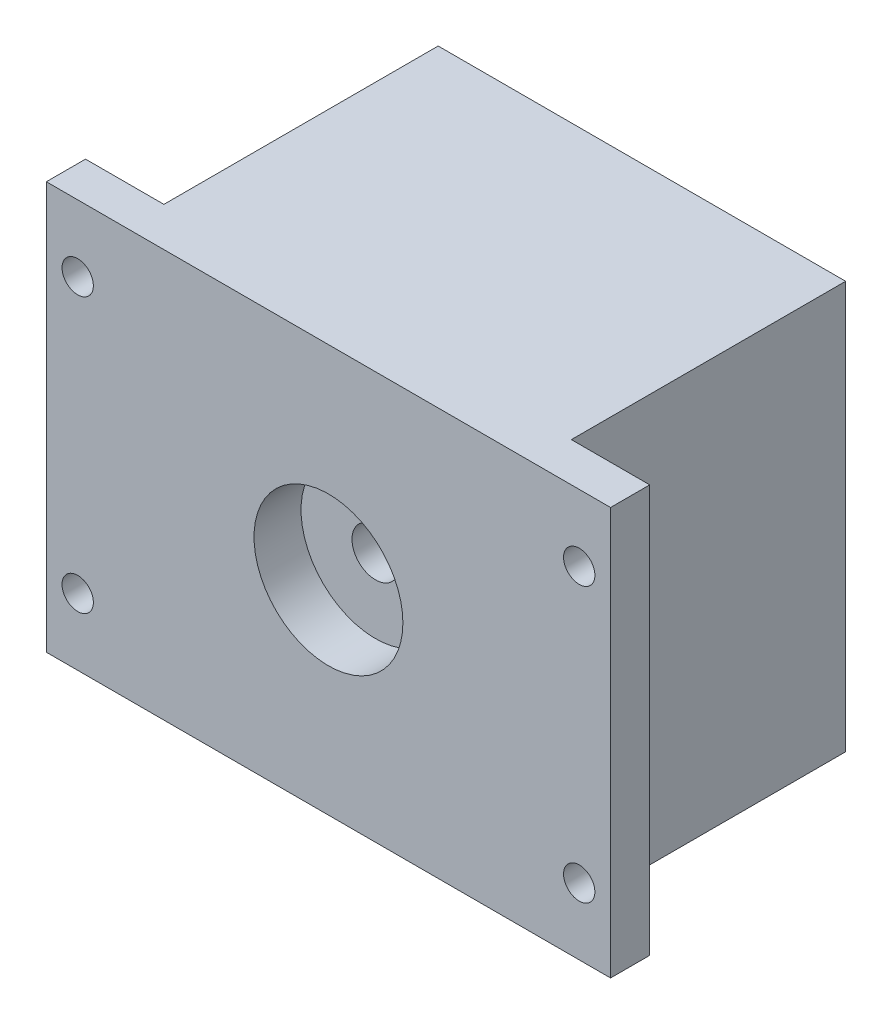
from build123d import *

# Parameters (mm, degrees)
SKETCH3_W           = 52
SKETCH3_H           = 52
BOSS_EXTRUDE1_DEPTH = 40
SKETCH4_R           = 3
CUT_EXTRUDE5_DEPTH  = 40
SKETCH4_5_R         = 9.5
SKETCH4_5_R_2       = 3
CUT_EXTRUDE6_DEPTH  = 6
CUT_EXTRUDE8_START  = -6
SKETCH5_R           = 9.5
CUT_EXTRUDE8_DEPTH  = 6
SKETCH6_W           = 10
SKETCH6_H           = 52
BOSS_EXTRUDE2_DEPTH = 5
SKETCH7_R           = 2
CUT_EXTRUDE9_DEPTH  = 5


with BuildPart() as part:
    # Sketch3 → Boss-Extrude1 (new body)
    with BuildSketch(Plane.XY):
        Rectangle(SKETCH3_W, SKETCH3_H)
    extrude(amount=BOSS_EXTRUDE1_DEPTH)

    # Sketch4 → Cut-Extrude5 (cut)
    with BuildSketch(Plane.XY.offset(40)):
        Circle(SKETCH4_R)
    extrude(amount=-CUT_EXTRUDE5_DEPTH, mode=Mode.SUBTRACT)

    # Sketch4<5> → Cut-Extrude6 (cut)
    with BuildSketch(Plane.XY.offset(40)):
        Circle(SKETCH4_5_R)
        Circle(SKETCH4_5_R_2, mode=Mode.SUBTRACT)
    extrude(amount=-CUT_EXTRUDE6_DEPTH, mode=Mode.SUBTRACT)

    # Sketch5 → Cut-Extrude8 (cut)
    with BuildSketch(Plane(origin=(0, 0, 0), x_dir=(-1, 0, 0), z_dir=(0, 0, -1)).offset(CUT_EXTRUDE8_START)):
        with Locations(Location((0, 0, 0), (0, 0, 180))):
            Circle(SKETCH5_R)
    extrude(amount=CUT_EXTRUDE8_DEPTH, mode=Mode.SUBTRACT)

    # Sketch6 → Boss-Extrude2 (add)
    with BuildSketch(Plane.XY.offset(40)):
        with Locations((31, 0)):
            Rectangle(SKETCH6_W, SKETCH6_H)
        with Locations((-31, 0)):
            Rectangle(SKETCH6_W, SKETCH6_H)
    extrude(amount=-BOSS_EXTRUDE2_DEPTH)

    # Sketch7 → Cut-Extrude9 (cut)
    with BuildSketch(Plane(origin=(0, 0, 35), x_dir=(-1, 0, 0), z_dir=(0, 0, -1))):
        with Locations((-32, 17.5)):
            Circle(SKETCH7_R)
        with Locations((32, 17.5)):
            Circle(SKETCH7_R)
        with Locations((32, -17.5)):
            Circle(SKETCH7_R)
        with Locations((-32, -17.5)):
            Circle(SKETCH7_R)
    extrude(amount=-CUT_EXTRUDE9_DEPTH, mode=Mode.SUBTRACT)


solid = part.part
